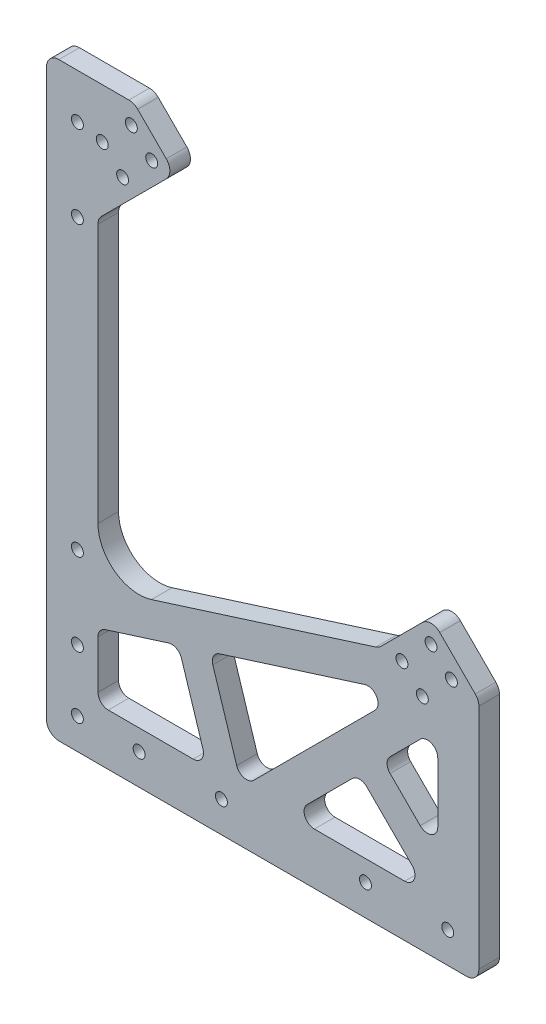
from build123d import *

# Parameters (mm, degrees)
SKETCH_1_R          = 1.45
EXTRUDE_1_DEPTH     = 5
EXTRUDE_2_DEPTH     = 5
FILLET_1_R          = 10
FILLET_2_R          = 2.5
CUT_EXTRUDE_1_DEPTH = 183.793945183
FILLET_3_R          = 3


with BuildPart() as part:
    # 草图1 → 凸台-拉伸1 (new body)
    with BuildSketch(Plane.XY):
        Polygon((-7.5, -7.5), (-7.5, 135.890872965), (13.765981284, 135.890872965), (23.715728753, 125.941125497), (5, 107.225396744), (5, 5), (39.953318806, 5), (79.577164466, 44.623845661), (73.213203436, 50.987806691), (85.941125497, 63.715728753), (122.156854249, 27.5), (122.156854249, -7.5), align=None)
        Circle(SKETCH_1_R, mode=Mode.SUBTRACT)
        with Locations((0, 15)):
            Circle(SKETCH_1_R, mode=Mode.SUBTRACT)
        with Locations((0, 35)):
            Circle(SKETCH_1_R, mode=Mode.SUBTRACT)
        with Locations((15, 0)):
            Circle(SKETCH_1_R, mode=Mode.SUBTRACT)
        with Locations((35, 0)):
            Circle(SKETCH_1_R, mode=Mode.SUBTRACT)
        with Locations((18.058874503, 125.941125497)):
            Circle(SKETCH_1_R, mode=Mode.SUBTRACT)
        with Locations((13.109127035, 130.890872965)):
            Circle(SKETCH_1_R, mode=Mode.SUBTRACT)
        with Locations((6.038059223, 123.819805153)):
            Circle(SKETCH_1_R, mode=Mode.SUBTRACT)
        with Locations((10.987806691, 118.870057685)):
            Circle(SKETCH_1_R, mode=Mode.SUBTRACT)
        with Locations((90.890872965, 53.109127035)):
            Circle(SKETCH_1_R, mode=Mode.SUBTRACT)
        with Locations((85.941125497, 58.058874503)):
            Circle(SKETCH_1_R, mode=Mode.SUBTRACT)
        with Locations((78.870057685, 50.987806691)):
            Circle(SKETCH_1_R, mode=Mode.SUBTRACT)
        with Locations((83.819805153, 46.038059223)):
            Circle(SKETCH_1_R, mode=Mode.SUBTRACT)
        with Locations((0, 125)):
            Circle(SKETCH_1_R, mode=Mode.SUBTRACT)
        with Locations((0, 105)):
            Circle(SKETCH_1_R, mode=Mode.SUBTRACT)
        with Locations((70, 0)):
            Circle(SKETCH_1_R, mode=Mode.SUBTRACT)
        with Locations((90, 0)):
            Circle(SKETCH_1_R, mode=Mode.SUBTRACT)
        Polygon((94.567828227, 48.01795821), (51.549870017, 5), (115.156854249, 5), (115.156854249, 27.428932188), align=None, mode=Mode.SUBTRACT)
    extrude(amount=EXTRUDE_1_DEPTH)

    # 草图3 → 凸台-拉伸2 (add)
    with BuildSketch(Plane.XY):
        Polygon((97.567828227, 45.01795821), (97.567828227, 5), (85.567828227, 5), (68.558849122, 22.008979105), (74.215703372, 27.665833355), (87.567828227, 14.313708499), (87.567828227, 41.01795821), (94.567828227, 48.01795821), align=None)
        Polygon((73.213203436, 50.987806691), (5, 29.379876147), (5, 21), (24.533181149, 27.187535555), (31.561537876, 5), (39.953318806, 5), (32.159691009, 29.603388895), (79.577164466, 44.623845661), align=None)
    extrude(amount=EXTRUDE_2_DEPTH)

    # 圆角1
    fillet_1_edges = [part.edges().sort_by_distance(p)[0] for p in [
        (5, 29.379876147, 2.5),
    ]]
    fillet(fillet_1_edges, radius=FILLET_1_R)

    # 圆角2
    fillet_2_edges = [part.edges().sort_by_distance(p)[0] for p in [
        (97.567828227, 5, 2.5),
        (85.567828227, 5, 2.5),
        (68.558849122, 22.008979105, 2.5),
        (74.215703372, 27.665833355, 2.5),
        (87.567828227, 14.313708499, 2.5),
        (87.567828227, 41.01795821, 2.5),
        (97.567828227, 45.01795821, 2.5),
        (32.159691009, 29.603388895, 2.5),
        (31.561537876, 5, 2.5),
        (24.533181149, 27.187535555, 2.5),
        (5, 21, 2.5),
        (5, 5, 2.5),
        (39.953318806, 5, 2.5),
        (79.577164466, 44.623845661, 2.5),
        (115.156854249, 27.428932188, 2.5),
        (51.549870017, 5, 2.5),
        (115.156854249, 5, 2.5),
    ]]
    fillet(fillet_2_edges, radius=FILLET_2_R)

    # 草图4 → 切除-拉伸1 (cut, through all)
    with BuildSketch(Plane.XY.offset(5)):
        Polygon((97.567828227, -7.5), (97.567828227, 52.089026022), (122.156854249, 27.5), (122.156854249, -7.5), align=None)
    extrude(amount=-CUT_EXTRUDE_1_DEPTH, mode=Mode.SUBTRACT)

    # 圆角3
    fillet_3_edges = [part.edges().sort_by_distance(p)[0] for p in [
        (-7.5, -7.5, 2.5),
        (-7.5, 135.890872965, 2.5),
        (13.765981284, 135.890872965, 2.5),
        (23.715728753, 125.941125497, 2.5),
        (5, 107.225396744, 2.5),
        (73.213203436, 50.987806691, 2.5),
        (85.941125497, 63.715728753, 2.5),
        (97.567828227, -7.5, 2.5),
        (97.567828227, 52.089026022, 2.5),
    ]]
    fillet(fillet_3_edges, radius=FILLET_3_R)


solid = part.part
